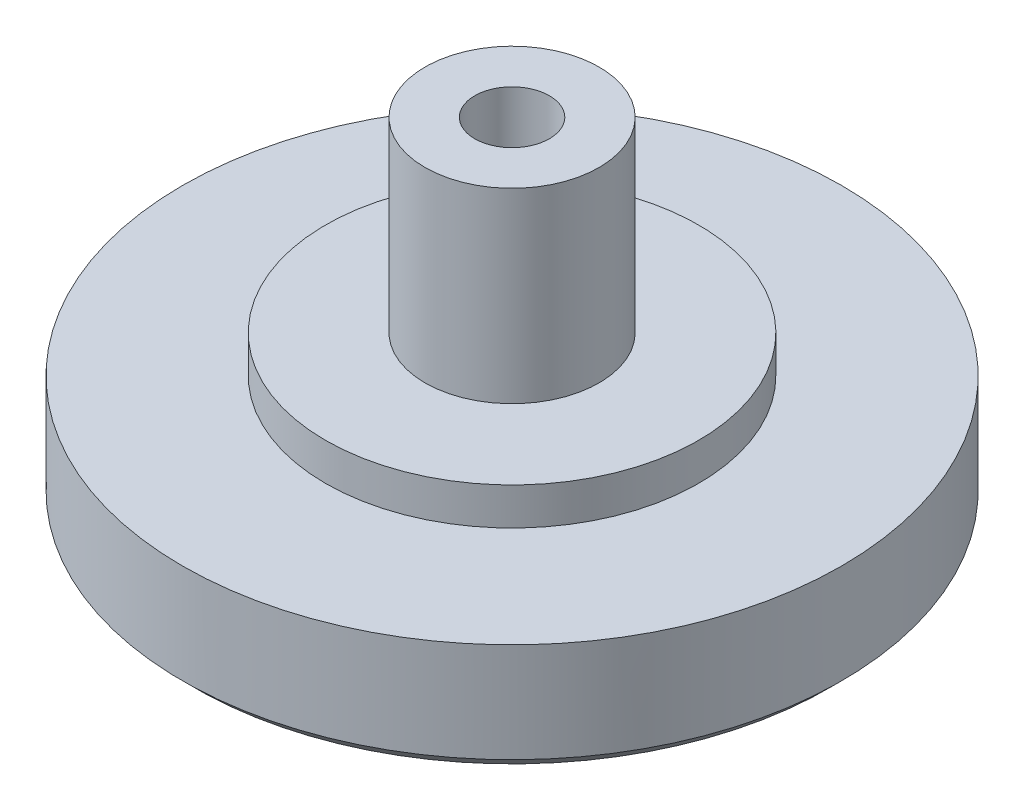
from build123d import *

# Parameters (mm, degrees)
CROQUIS2_R              = 26.5
SALIENTE_EXTRUIR1_DEPTH = 8
CROQUIS3_R              = 26.5
SALIENTE_EXTRUIR2_DEPTH = 1
SALIENTE_EXTRUIR2_TAPER = 45
CROQUIS4_R              = 17.5
SALIENTE_EXTRUIR3_DEPTH = 1
CROQUIS5_R              = 15
SALIENTE_EXTRUIR4_DEPTH = 3
CROQUIS6_R              = 7
SALIENTE_EXTRUIR5_DEPTH = 15
CROQUIS7_R              = 3
CORTAR_EXTRUIR1_DEPTH   = 9


with BuildPart() as part:
    # Croquis2 → Saliente-Extruir1 (new body)
    with BuildSketch(Plane(origin=(0, 0, 0), x_dir=(1, 0, 0), z_dir=(0, 1, 0))):
        with Locations(Location((0, 0, 0), (0, 0, 270))):
            Circle(CROQUIS2_R)
    extrude(amount=SALIENTE_EXTRUIR1_DEPTH)

    # Croquis3 → Saliente-Extruir2 (add)
    with BuildSketch(Plane(origin=(0, 0, 0), x_dir=(-1, 0, 0), z_dir=(0, -1, 0))):
        with Locations(Location((0, 0, 0), (0, 0, 90))):
            Circle(CROQUIS3_R)
    extrude(amount=SALIENTE_EXTRUIR2_DEPTH, taper=SALIENTE_EXTRUIR2_TAPER)

    # Croquis4 → Saliente-Extruir3 (add)
    with BuildSketch(Plane(origin=(0, -1, 0), x_dir=(-1, 0, 0), z_dir=(0, -1, 0))):
        with Locations(Location((0, 0, 0), (0, 0, 90))):
            Circle(CROQUIS4_R)
    extrude(amount=SALIENTE_EXTRUIR3_DEPTH)

    # Croquis5 → Saliente-Extruir4 (add)
    with BuildSketch(Plane(origin=(0, 8, 0), x_dir=(1, 0, 0), z_dir=(0, 1, 0))):
        with Locations(Location((0, 0, 0), (0, 0, 270))):
            Circle(CROQUIS5_R)
    extrude(amount=SALIENTE_EXTRUIR4_DEPTH)

    # Croquis6 → Saliente-Extruir5 (add)
    with BuildSketch(Plane(origin=(0, 11, 0), x_dir=(1, 0, 0), z_dir=(0, 1, 0))):
        with Locations(Location((0, 0, 0), (0, 0, 270))):
            Circle(CROQUIS6_R)
    extrude(amount=SALIENTE_EXTRUIR5_DEPTH)

    # Croquis7 → Cortar-Extruir1 (cut)
    with BuildSketch(Plane(origin=(0, 26, 0), x_dir=(1, 0, 0), z_dir=(0, 1, 0))):
        with Locations(Location((0, 0, 0), (0, 0, 270))):
            Circle(CROQUIS7_R)
    extrude(amount=-CORTAR_EXTRUIR1_DEPTH, mode=Mode.SUBTRACT)


solid = part.part
